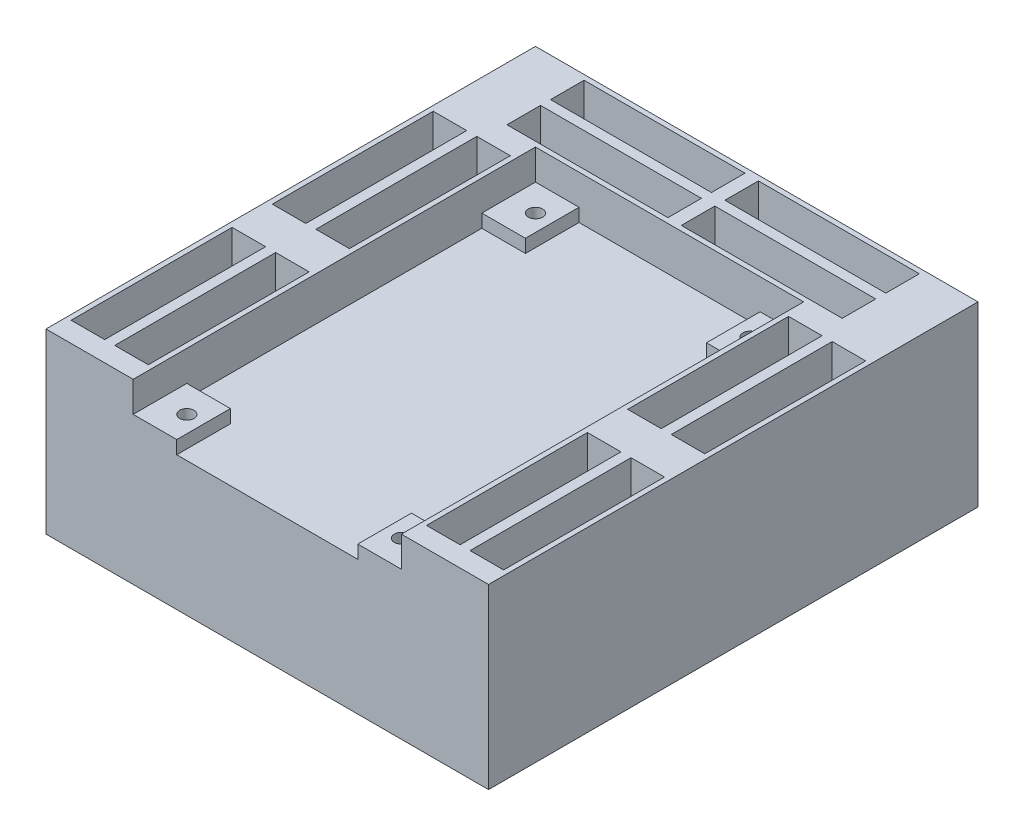
from build123d import *

# Parameters (mm, degrees)
BOSS_EXTRUDE1_DEPTH     = 76.2
SKETCH3_W               = 6.35
SKETCH3_H               = 30.48
CUT_EXTRUDE1_DEPTH      = 31.75
LPATTERN11_COUNT        = 2
LPATTERN11_PITCH        = 8.255
SKETCH4_W               = 41.91
SKETCH4_H               = 33.655
BOSS_EXTRUDE2_DEPTH     = 16.51
SKETCH5_W               = 30.48
SKETCH5_H               = 6.35
CUT_EXTRUDE2_DEPTH      = 31.75
SKETCH6_R               = 1.35
CUT_EXTRUDE3_DEPTH      = 5
SKETCH9_W               = 8.255
SKETCH9_H               = 55.88
CUT_EXTRUDE5_DEPTH      = 2.5
LPATTERN12_COUNT        = 2
LPATTERN12_PITCH        = 8.255
MIRROR3_COPY_1_SKETCH_W = 6.35
MIRROR3_COPY_1_SKETCH_H = 30.48
MIRROR3_COPY_1_DEPTH    = 31.75
MIRROR3_COPY_2_SKETCH_W = 30.48
MIRROR3_COPY_2_SKETCH_H = 6.35
MIRROR3_COPY_2_DEPTH    = 31.75


with BuildPart() as part:
    # Sketch2 → Boss-Extrude1 (new body)
    with BuildSketch(Plane.XY):
        Polygon((0, 0), (41.91, 0), (41.91, 33.655), (25.4, 33.655), (25.4, 27.9), (17.145, 27.9), (17.145, 25.4), (0, 25.4), align=None)
    boss_extrude1 = extrude(amount=-BOSS_EXTRUDE1_DEPTH)

    # Sketch3 → Cut-Extrude1 (cut)
    with BuildSketch(Plane(origin=(0, 33.655, 0), x_dir=(1, 0, 0), z_dir=(0, 1, 0))):
        with Locations((29.5275, 19.05)):
            Rectangle(SKETCH3_W, SKETCH3_H)
        with Locations((29.5275, 57.15)):
            Rectangle(SKETCH3_W, SKETCH3_H)
    cut_extrude1 = extrude(amount=-CUT_EXTRUDE1_DEPTH, mode=Mode.SUBTRACT)

    # LPattern11: Cut-Extrude1 ×2
    with Locations(*[(i * LPATTERN11_PITCH, 0, 0) for i in range(1, LPATTERN11_COUNT)]):
        add(cut_extrude1, mode=Mode.SUBTRACT)

    # Sketch4 → Boss-Extrude2 (add)
    with BuildSketch(Plane(origin=(0, 0, -76.2), x_dir=(-1, 0, 0), z_dir=(0, 0, -1))):
        with Locations((-20.955, 16.8275)):
            Rectangle(SKETCH4_W, SKETCH4_H)
    boss_extrude2 = extrude(amount=BOSS_EXTRUDE2_DEPTH)

    # Sketch5 → Cut-Extrude2 (cut)
    with BuildSketch(Plane(origin=(0, 33.655, 0), x_dir=(1, 0, 0), z_dir=(0, 1, 0))):
        with Locations((16.51, 80.3275)):
            Rectangle(SKETCH5_W, SKETCH5_H)
    cut_extrude2 = extrude(amount=-CUT_EXTRUDE2_DEPTH, mode=Mode.SUBTRACT)

    # Sketch6 → Cut-Extrude3 (cut)
    with BuildSketch(Plane(origin=(0, 27.9, 0), x_dir=(1, 0, 0), z_dir=(0, 1, 0))):
        with Locations(Location((20.32, 5.08, 0), (0, 0, 270))):
            Circle(SKETCH6_R)
        with Locations(Location((20.32, 71.12, 0), (0, 0, 270))):
            Circle(SKETCH6_R)
    cut_extrude3 = extrude(amount=-CUT_EXTRUDE3_DEPTH, mode=Mode.SUBTRACT)

    # Sketch9 → Cut-Extrude5 (cut)
    with BuildSketch(Plane(origin=(0, 27.9, 0), x_dir=(1, 0, 0), z_dir=(0, 1, 0))):
        with Locations((21.2725, 38.1)):
            Rectangle(SKETCH9_W, SKETCH9_H)
    cut_extrude5 = extrude(amount=-CUT_EXTRUDE5_DEPTH, mode=Mode.SUBTRACT)

    # LPattern12: Cut-Extrude2 ×2
    with Locations(*[(0, 0, -i * LPATTERN12_PITCH) for i in range(1, LPATTERN12_COUNT)]):
        add(cut_extrude2, mode=Mode.SUBTRACT)

    # Mirror3: Boss-Extrude1, Cut-Extrude1, Boss-Extrude2, Cut-Extrude2, Cut-Extrude3, Cut-Extrude5 across plane
    add(boss_extrude1.mirror(Plane(origin=(0, 25.4, -76.2), x_dir=(0, 0, 1), z_dir=(-1, 0, 0))))
    add(cut_extrude1.mirror(Plane(origin=(0, 25.4, -76.2), x_dir=(0, 0, 1), z_dir=(-1, 0, 0))), mode=Mode.SUBTRACT)
    add(boss_extrude2.mirror(Plane(origin=(0, 25.4, -76.2), x_dir=(0, 0, 1), z_dir=(-1, 0, 0))))
    add(cut_extrude2.mirror(Plane(origin=(0, 25.4, -76.2), x_dir=(0, 0, 1), z_dir=(-1, 0, 0))), mode=Mode.SUBTRACT)
    add(cut_extrude3.mirror(Plane(origin=(0, 25.4, -76.2), x_dir=(0, 0, 1), z_dir=(-1, 0, 0))), mode=Mode.SUBTRACT)
    add(cut_extrude5.mirror(Plane(origin=(0, 25.4, -76.2), x_dir=(0, 0, 1), z_dir=(-1, 0, 0))), mode=Mode.SUBTRACT)

    # Mirror3 copy 1 sketch → Mirror3 copy 1 (cut)
    with BuildSketch(Plane(origin=(-8.255, 33.655, 0), x_dir=(-1, 0, 0), z_dir=(0, 1, 0))):
        with Locations((29.5275, -19.05)):
            Rectangle(MIRROR3_COPY_1_SKETCH_W, MIRROR3_COPY_1_SKETCH_H)
        with Locations((29.5275, -57.15)):
            Rectangle(MIRROR3_COPY_1_SKETCH_W, MIRROR3_COPY_1_SKETCH_H)
    extrude(amount=-MIRROR3_COPY_1_DEPTH, mode=Mode.SUBTRACT)

    # Mirror3 copy 2 sketch → Mirror3 copy 2 (cut)
    with BuildSketch(Plane(origin=(0, 33.655, -8.255), x_dir=(-1, 0, 0), z_dir=(0, 1, 0))):
        with Locations((16.51, -80.3275)):
            Rectangle(MIRROR3_COPY_2_SKETCH_W, MIRROR3_COPY_2_SKETCH_H)
    extrude(amount=-MIRROR3_COPY_2_DEPTH, mode=Mode.SUBTRACT)


solid = part.part
